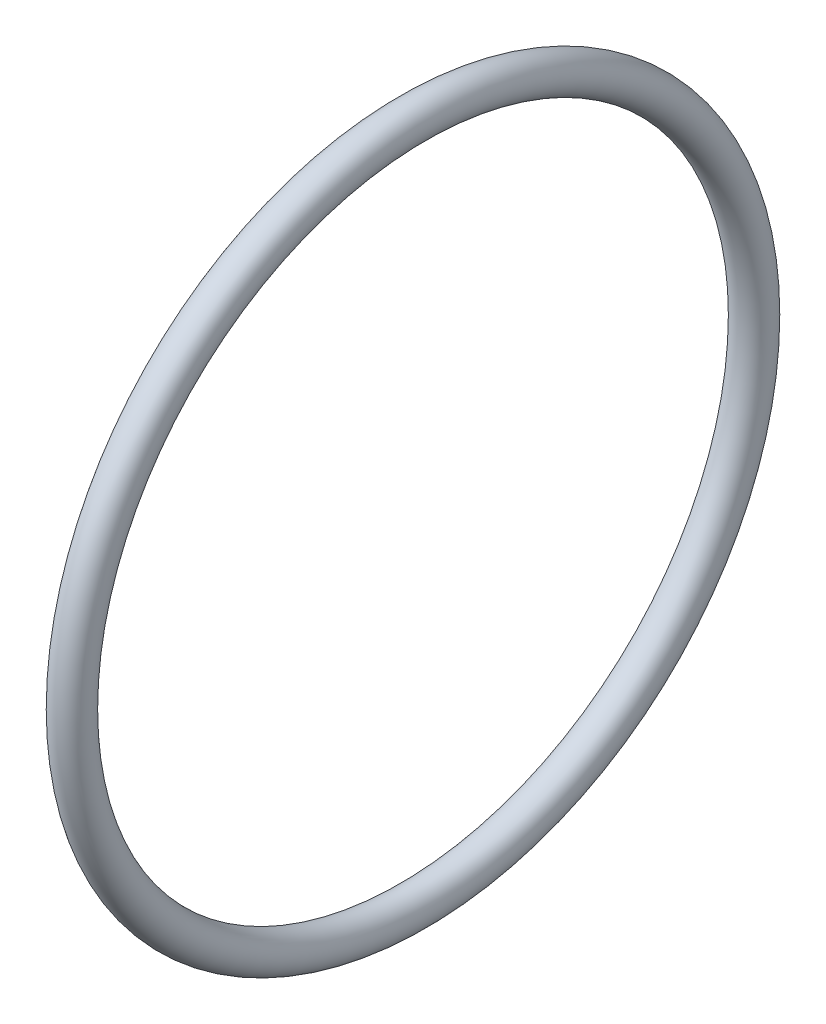
from build123d import *

# Parameters (mm, degrees)
SKETCH_1_R = 1


with BuildPart() as part:
    # ｽｹｯﾁ1 → 回転1 (revolve)
    with BuildSketch(Plane.XY, mode=Mode.PRIVATE) as revolve_1_sk:
        with Locations((0, 18.75)):
            Circle(SKETCH_1_R)
    revolve(revolve_1_sk.sketch.rotate(Axis((0, 0, 0), (1, 0, 0)), 90), axis=Axis((0, 0, 0), (1, 0, 0)))


solid = part.part
